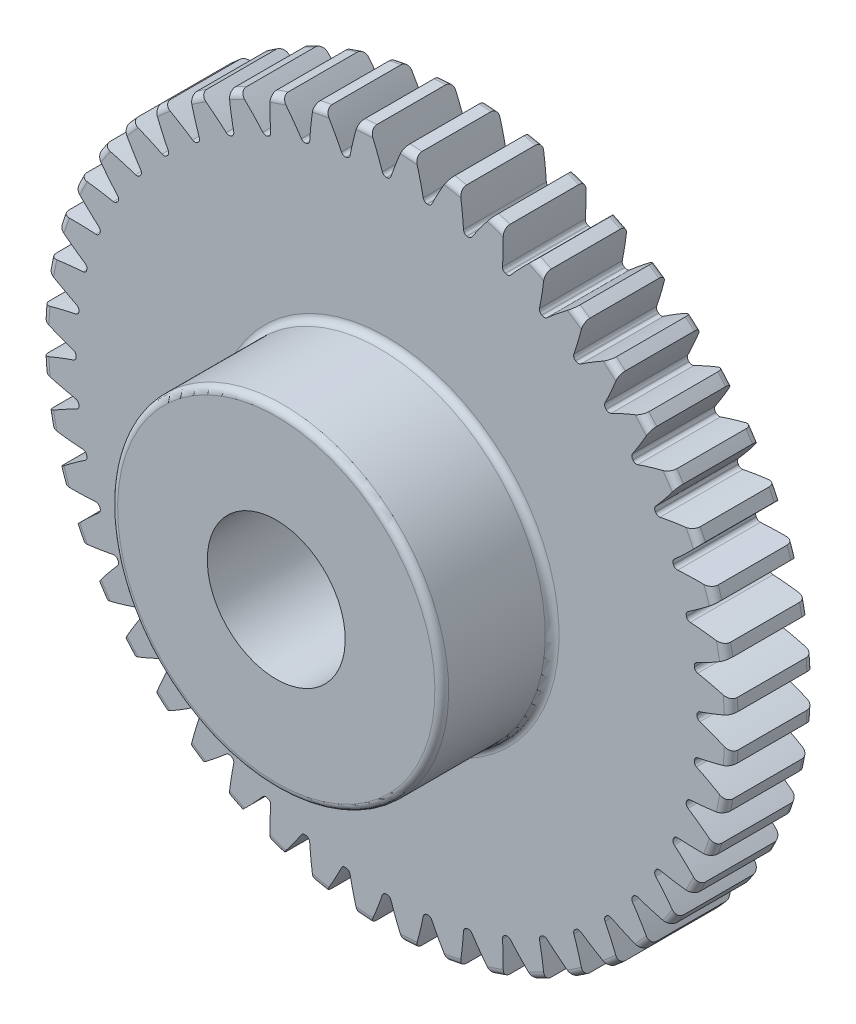
from build123d import *

# Parameters (mm, degrees)
FILLET2_R          = 0.25
CUT_EXTRUDE2_DEPTH = 19.12456896
CIRPATTERN1_COUNT  = 48


with BuildPart() as part:
    # Sketch4 → Revolve1 (revolve)
    with BuildSketch(Plane(origin=(0, 0, 0), x_dir=(0, 0, -1), z_dir=(1, 0, 0))):
        Polygon((-7, 2.5), (-7, 6), (-3, 6), (-3, 12.5), (0, 12.5), (0, 2.5), align=None)
    revolve(axis=Axis((0, 0, 3), (0, 0, 1)))

    # Fillet2
    fillet2_edges = [part.edges().sort_by_distance(p)[0] for p in [
        (0, -12.5, 0),
        (0, -12.5, 3),
        (0, -6, 3),
        (0, -6, 7),
    ]]
    fillet(fillet2_edges, radius=FILLET2_R)

    # Sketch7 → Cut-Extrude2 (cut, through all)
    with BuildSketch(Plane.XY.offset(3)):
        with BuildLine():
            ThreePointArc((-0.013730525, 11.249991621), (0, 11.25), (0.013730525, 11.249991621))
            ThreePointArc((0.013730525, 11.249991621), (0.101365894, 11.278119802), (0.156080652, 11.352129583))
            ThreePointArc((0.156080652, 11.352129583), (0.365129588, 11.924463901), (0.602960784, 12.485449063))
            ThreePointArc((0.602960784, 12.485449063), (0, 12.5), (-0.602960784, 12.485449063))
            ThreePointArc((-0.602960784, 12.485449063), (-0.365129588, 11.924463901), (-0.156080652, 11.352129583))
            ThreePointArc((-0.156080652, 11.352129583), (-0.101365894, 11.278119802), (-0.013730525, 11.249991621))
        make_face()
    cut_extrude2 = extrude(amount=-CUT_EXTRUDE2_DEPTH, mode=Mode.SUBTRACT)

    # CirPattern1: Cut-Extrude2 ×48 about axis
    cirpattern1_axis = Axis((0, 0, 0), (0, 0, 1))
    for i in range(1, CIRPATTERN1_COUNT):
        add(cut_extrude2.rotate(cirpattern1_axis, i * 360 / CIRPATTERN1_COUNT), mode=Mode.SUBTRACT)


solid = part.part
